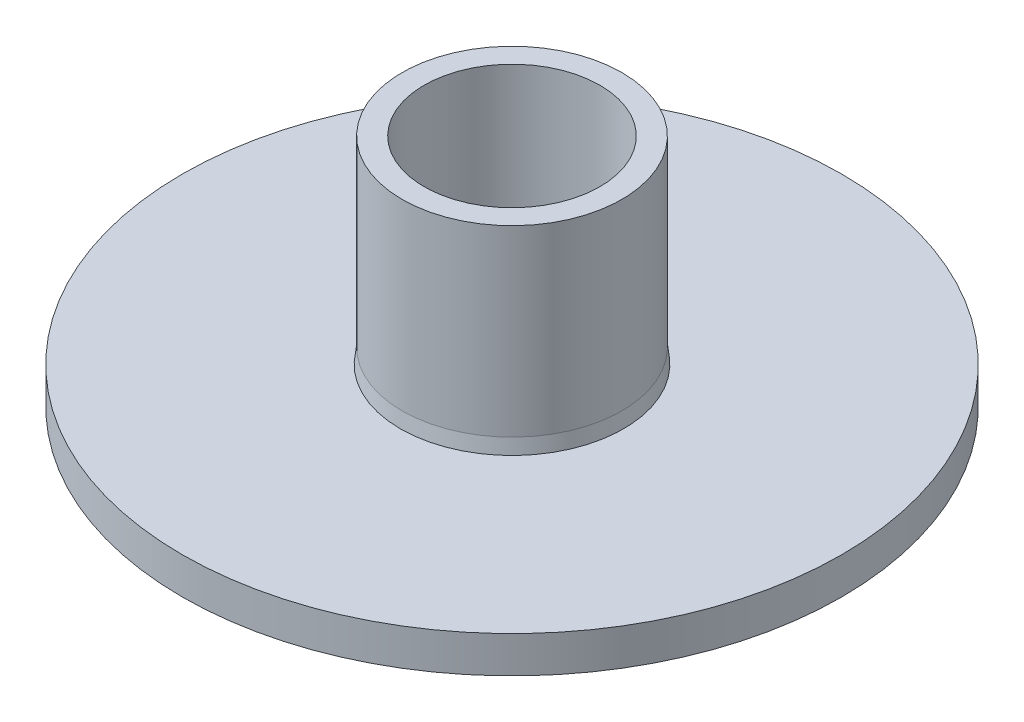
from build123d import *

# Parameters (mm, degrees)
RACCORDO2_R = 0.2


with BuildPart() as part:
    # Schizzo1 → Rivoluzione1 (revolve)
    with BuildSketch(Plane.XY, mode=Mode.PRIVATE) as rivoluzione1_sk:
        Polygon((-45, 5), (-45, 0), (-34.4, 0), (-34.4, 1.3), (-32, 1.3), (-32, 0), (-29.5, 0), (-29.5, 1.3), (-27.1, 1.3), (-27.1, 0), (-24, 0), (-18.4, 0), (-18.4, 1.3), (-16, 1.3), (-16, 0), (-13, 0), (-12, 8.5), (-12, 32), (-15, 32), (-15, 7), (-15.235294118, 5), align=None)
    revolve(rivoluzione1_sk.sketch.rotate(Axis((0, 0, 0), (0, 1, 0)), 270), axis=Axis((0, 0, 0), (0, 1, 0)))

    # Raccordo2
    raccordo2_edges = [part.edges().sort_by_distance(p)[0] for p in [
        (0, 1.3, 16),
        (0, 1.3, 18.4),
        (0, 1.3, 27.1),
        (0, 1.3, 29.5),
        (0, 1.3, 32),
        (0, 1.3, 34.4),
    ]]
    fillet(raccordo2_edges, radius=RACCORDO2_R)


solid = part.part
